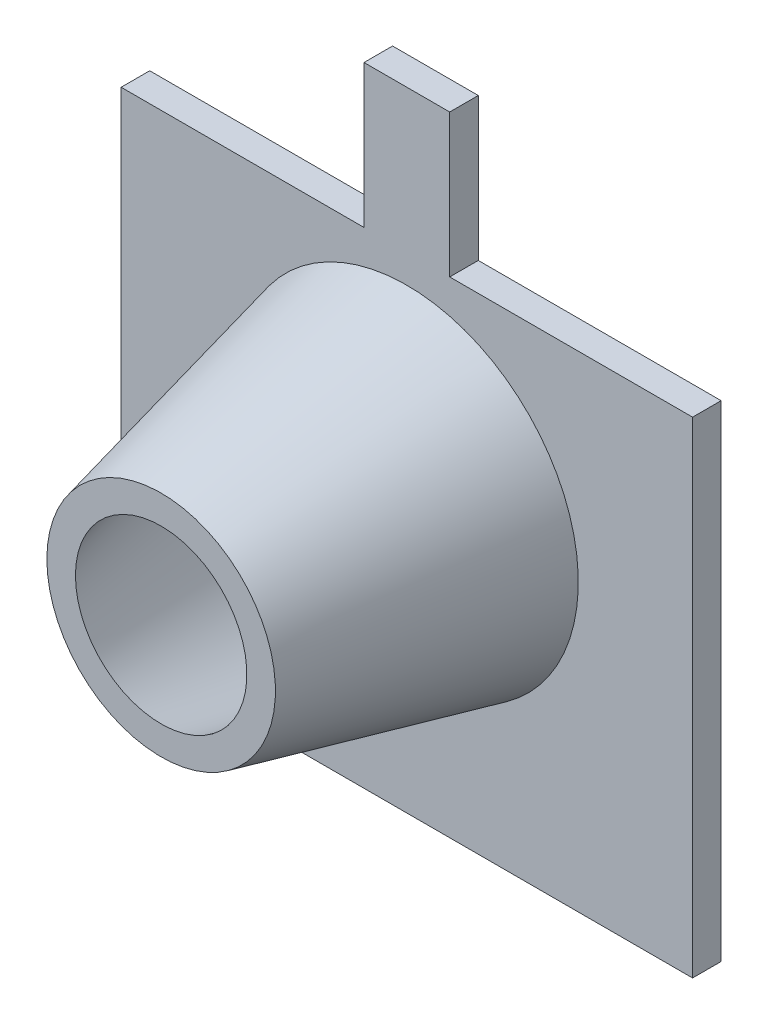
from build123d import *

# Parameters (mm, degrees)
MINUS_PLATE_10_X_8_5_X_0_5_SKETCH_W = 10
MINUS_PLATE_10_X_8_5_X_0_5_SKETCH_H = 0.5
MINUS_PLATE_10_X_8_5_X_0_5_DEPTH    = 8.5
SOLDER_TAB_1_5_X_2_5_SKETCH_W       = 1.5
SOLDER_TAB_1_5_X_2_5_SKETCH_H       = 0.5
SOLDER_TAB_1_5_X_2_5_DEPTH          = 2.5


with BuildPart() as part:
    # Minus Plate 10 x 8.5 x 0.5 Sketch → Minus Plate 10 x 8.5 x 0.5 (new body)
    with BuildSketch(Plane(origin=(0, 1.95, 0), x_dir=(1, 0, 0), z_dir=(0, 1, 0))):
        with Locations((25.7, 65.1)):
            Rectangle(MINUS_PLATE_10_X_8_5_X_0_5_SKETCH_W, MINUS_PLATE_10_X_8_5_X_0_5_SKETCH_H)
    extrude(amount=MINUS_PLATE_10_X_8_5_X_0_5_DEPTH)

    # Solder Tab 1.5 x 2.5 Sketch → Solder Tab 1.5 x 2.5 (add)
    with BuildSketch(Plane(origin=(0, 10.45, 0), x_dir=(1, 0, 0), z_dir=(0, 1, 0))):
        with Locations((25.7, 65.1)):
            Rectangle(SOLDER_TAB_1_5_X_2_5_SKETCH_W, SOLDER_TAB_1_5_X_2_5_SKETCH_H)
    extrude(amount=SOLDER_TAB_1_5_X_2_5_DEPTH)

    # Spring (compressed 4.3) Sketch → Spring (compressed 4.3) (revolve)
    with BuildSketch(Plane(origin=(0, 6.95, 0), x_dir=(1, 0, 0), z_dir=(0, 1, 0)), mode=Mode.PRIVATE) as spring_compressed_4_3_sk:
        Polygon((28.2, 64.85), (28.7, 64.85), (27.7, 60.55), (27.2, 60.55), align=None)
    revolve(spring_compressed_4_3_sk.sketch.rotate(Axis((25.7, 6.95, -65.85), (0, 0, 1)), 180), axis=Axis((25.7, 6.95, -65.85), (0, 0, 1)))


solid = part.part
